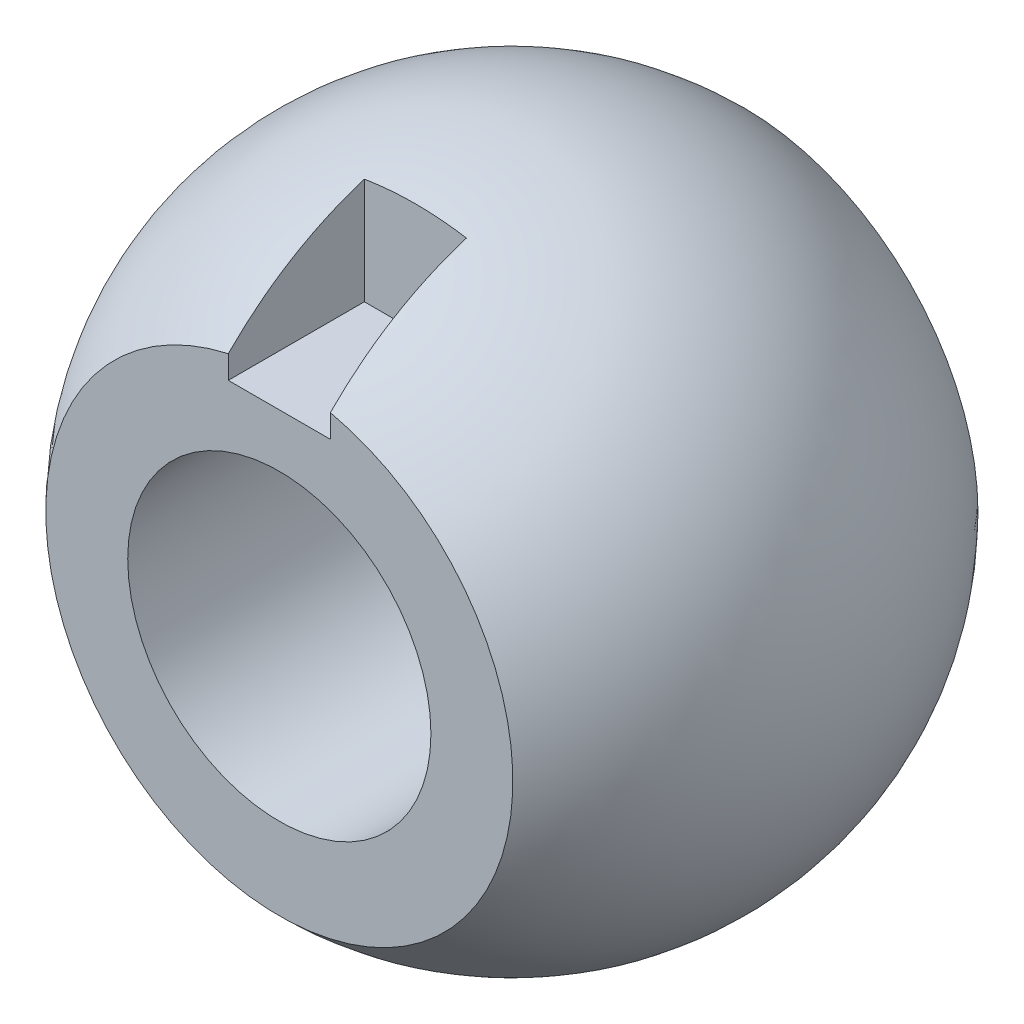
from build123d import *

# Parameters (mm, degrees)
CUT_EXTRUDE1_DEPTH      = 14.638168059
CUT_EXTRUDE1_DEPTH_BACK = 14.638168059
SKETCH2_R               = 3.62204
CUT_EXTRUDE2_START      = 5.55625
SKETCH3_R               = 15.748
CUT_EXTRUDE2_DEPTH      = 9.081918059
CUT_EXTRUDE3_START      = -5.55625
SKETCH3_2_R             = 15.748
CUT_EXTRUDE3_DEPTH      = 9.081918059
CUT_EXTRUDE4_DEPTH      = 3.2512


with BuildPart() as part:
    # Sketch1 → Revolve1 (revolve)
    with BuildSketch(Plane.XY):
        with BuildLine():
            Line((0, 7.874), (0, -7.874))
            ThreePointArc((0, -7.874), (-7.874, 0), (0, 7.874))
        make_face()
    revolve(axis=Axis((0, 7.874, 0), (0, -1, 0)))

    # Sketch2 → Cut-Extrude1 (cut, two sides: drawn at the far end of the back side and taken through both)
    with BuildSketch(Plane.XY.offset(-CUT_EXTRUDE1_DEPTH_BACK)):
        Circle(SKETCH2_R)
    extrude(amount=CUT_EXTRUDE1_DEPTH + CUT_EXTRUDE1_DEPTH_BACK, mode=Mode.SUBTRACT)

    # Sketch3 → Cut-Extrude2 (cut, through all)
    with BuildSketch(Plane.XY.offset(CUT_EXTRUDE2_START)):
        Circle(SKETCH3_R)
    extrude(amount=CUT_EXTRUDE2_DEPTH, mode=Mode.SUBTRACT)

    # Sketch3<2> → Cut-Extrude3 (cut, through all)
    with BuildSketch(Plane.XY.offset(CUT_EXTRUDE3_START)):
        Circle(SKETCH3_2_R)
    extrude(amount=-CUT_EXTRUDE3_DEPTH, mode=Mode.SUBTRACT)

    # Sketch4 → Cut-Extrude4 (cut)
    with BuildSketch(Plane.XY.offset(5.55625)):
        Polygon((0, 4.89204), (1.2192, 4.89204), (1.2192, 13.166366441), (0, 13.166366441), (-1.2192, 13.166366441), (-1.2192, 4.89204), align=None)
    extrude(amount=-CUT_EXTRUDE4_DEPTH, mode=Mode.SUBTRACT)


solid = part.part
